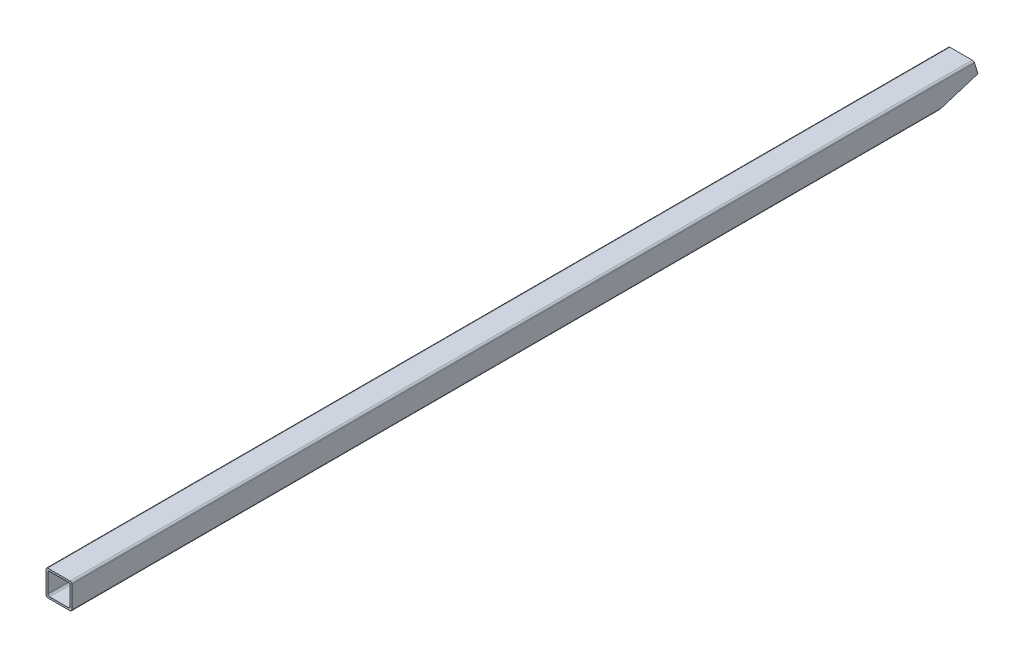
from build123d import *

# Parameters (mm, degrees)
BOSS_EXTRUDE1_DEPTH = 1340
CUT_EXTRUDE1_DEPTH  = 1342.082853518


with BuildPart() as part:
    # Sketch1 → Boss-Extrude1 (new body)
    with BuildSketch(Plane.XY):
        with BuildLine():
            Line((2.54, 0), (35.56, 0))
            ThreePointArc((35.56, 0), (37.356051224, -0.743948776), (38.1, -2.54))
            Line((38.1, -2.54), (38.1, -35.56))
            ThreePointArc((38.1, -35.56), (37.356051224, -37.356051224), (35.56, -38.1))
            Line((35.56, -38.1), (2.54, -38.1))
            ThreePointArc((2.54, -38.1), (0.743948776, -37.356051224), (0, -35.56))
            Line((0, -35.56), (0, -2.54))
            ThreePointArc((0, -2.54), (0.743948776, -0.743948776), (2.54, 0))
        make_face()
        with BuildLine():
            Line((5.3086, -2.7686), (32.7914, -2.7686))
            ThreePointArc((32.7914, -2.7686), (34.587451224, -3.512548776), (35.3314, -5.3086))
            Line((35.3314, -5.3086), (35.3314, -32.7914))
            ThreePointArc((35.3314, -32.7914), (34.587451224, -34.587451224), (32.7914, -35.3314))
            Line((32.7914, -35.3314), (5.3086, -35.3314))
            ThreePointArc((5.3086, -35.3314), (3.512548776, -34.587451224), (2.7686, -32.7914))
            Line((2.7686, -32.7914), (2.7686, -5.3086))
            ThreePointArc((2.7686, -5.3086), (3.512548776, -3.512548776), (5.3086, -2.7686))
        make_face(mode=Mode.SUBTRACT)
    extrude(amount=BOSS_EXTRUDE1_DEPTH)

    # Sketch2 → Cut-Extrude1 (cut, through all)
    with BuildSketch(Plane.ZY):
        Polygon((0, -2.54), (5.15810206, -2.54), (5.951656223, 0), (0, 0), align=None)
        Polygon((0, -2.54), (0, -19.05), (5.15810206, -2.54), align=None)
        Polygon((52.845038121, -35.56), (0, -19.05), (0, -35.56), align=None)
        Polygon((60.975043986, -38.1), (52.845038121, -35.56), (0, -35.56), (0, -38.1), align=None)
    extrude(amount=-CUT_EXTRUDE1_DEPTH, mode=Mode.SUBTRACT)


solid = part.part
